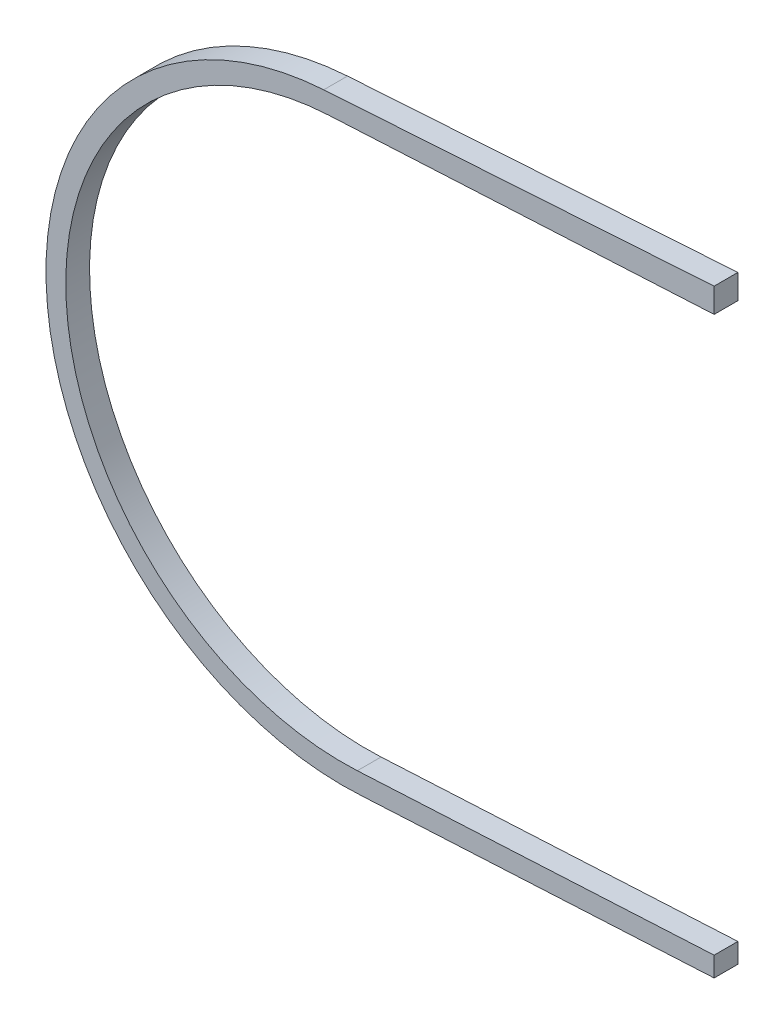
from build123d import *

# Parameters (mm, degrees)
BOSS_EXTRUDE1_DEPTH = 6


with BuildPart() as part:
    # Sketch1 → Boss-Extrude1 (new body)
    with BuildSketch(Plane.XY):
        with BuildLine():
            Line((-4.823085314, 74.844758321), (93.809651912, 81.200769309))
            Line((93.809651912, 81.200769309), (93.809651912, 75.010145935))
            Line((93.809651912, 75.010145935), (-3.661890691, 69.904152642))
            ThreePointArc((-3.661890691, 69.904152642), (-69.904152642, -3.661890691), (3.661890691, -69.904152642))
            Line((3.661890691, -69.904152642), (93.809651912, -65.181811619))
            Line((93.809651912, -65.181811619), (93.809651912, -70.183245841))
            Line((93.809651912, -70.183245841), (4.823085314, -74.844758321))
            ThreePointArc((4.823085314, -74.844758321), (-74.844758321, -4.823085314), (-4.823085314, 74.844758321))
        make_face()
    extrude(amount=BOSS_EXTRUDE1_DEPTH)


solid = part.part
